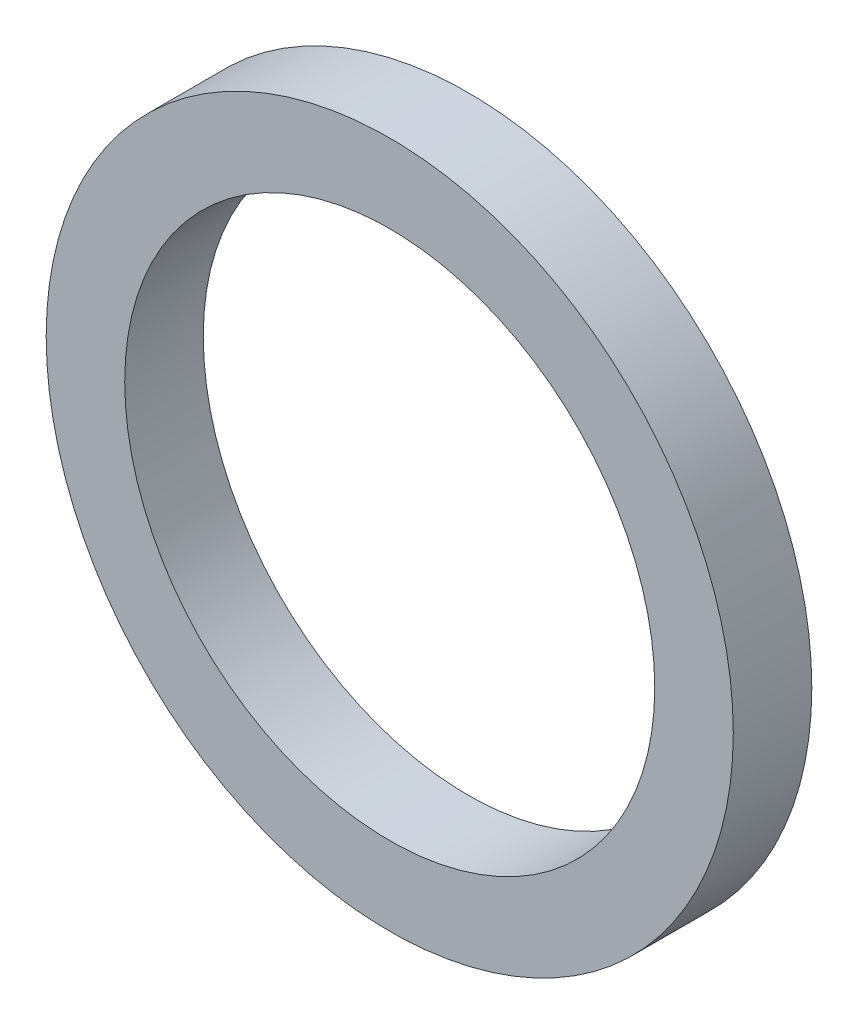
from build123d import *

# Parameters (mm, degrees)
SKETCH_1_R      = 7
SKETCH_1_R_2    = 5.4
EXTRUDE_1_DEPTH = 1.6


with BuildPart() as part:
    # ｽｹｯﾁ1 → ﾎﾞｽ - 押し出し1 (new body)
    with BuildSketch(Plane.XY):
        Circle(SKETCH_1_R)
        Circle(SKETCH_1_R_2, mode=Mode.SUBTRACT)
    extrude(amount=EXTRUDE_1_DEPTH)


solid = part.part
